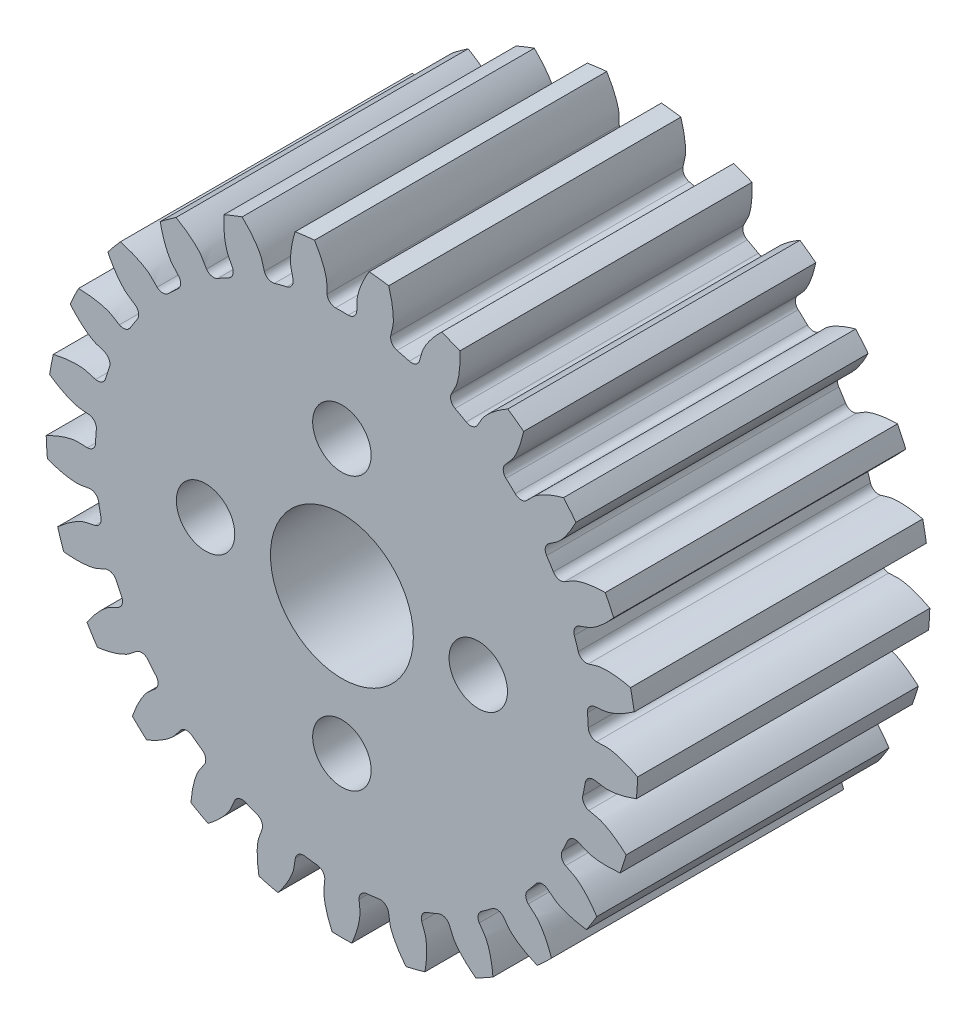
from build123d import *

# Parameters (mm, degrees)
SKETCH_1_R          = 15.1875
LASHENA_DEPTH       = 15
CUT_EXTRUDEA_DEPTH  = 15
WWW_KYTOOL_CN_COUNT = 25
SKETCH_2_R          = 1.5
CUT_EXTRUDE_1_DEPTH = 27.193824405
SKETCH_3_R          = 10.1
CUT_EXTRUDE_2_DEPTH = 5
SKETCH_4_R          = 3.668826936
CUT_EXTRUDE_3_DEPTH = 10


with BuildPart() as part:
    # 草图1 → LaShenA (new body)
    with BuildSketch(Plane.XY):
        Circle(SKETCH_1_R)
    extrude(amount=LASHENA_DEPTH)

    # SketchA → Cut-ExtrudeA (cut)
    with BuildSketch(Plane.XY.offset(15)):
        with BuildLine():
            ThreePointArc((0.324443957, 12.652090743), (0, 12.65625), (-0.324443957, 12.652090743))
            ThreePointArc((-0.324443957, 12.652090743), (-0.622114469, 12.762349707), (-0.76170327, 13.047445726))
            add(Edge.make_bspline(
                [(-0.76170327, 13.047445726), (-0.775328228, 13.228930177), (-0.759394526, 13.44165743), (-0.788755156, 13.664934603), (-0.799675486, 13.722720233), (-0.809304298, 13.768536103), (-0.821659042, 13.821123901), (-0.837010482, 13.880389795), (-0.855686072, 13.946216468), (-0.877989942, 14.018479865), (-0.904228386, 14.097043919), (-0.93470134, 14.181762379), (-0.969704609, 14.272478415), (-1.009528763, 14.369024922), (-1.054459055, 14.471224618), (-1.104775036, 14.578890226), (-1.160750274, 14.691824636), (-1.222652034, 14.809821084), (-1.290740991, 14.932663338), (-1.365270926, 15.060125898), (-1.446488467, 15.191974195), (-1.534632695, 15.327964812), (-1.66440648, 15.518440882), (-1.768856304, 15.660717762), (-1.842005537, 15.755887549)],
                knots=[0.123705737, 0.123705737, 0.123705737, 0.123705737, 0.284026838, 0.310496331, 0.322146932, 0.335915822, 0.351803004, 0.369808477, 0.38993224, 0.412174294, 0.436534639, 0.463013274, 0.491610201, 0.522325418, 0.555158926, 0.590110724, 0.627180814, 0.666369194, 0.707675866, 0.751100828, 0.796644081, 0.844305624, 0.894085459, 1, 1, 1, 1], degree=3))
            ThreePointArc((-1.842005537, 15.755887549), (0, 15.86319567), (1.842005537, 15.755887549))
            add(Edge.make_bspline(
                [(0.76170327, 13.047445726), (0.775328228, 13.228930177), (0.759394526, 13.44165743), (0.788755156, 13.664934603), (0.799675486, 13.722720233), (0.809304298, 13.768536103), (0.821659042, 13.821123901), (0.837010482, 13.880389795), (0.855686072, 13.946216468), (0.877989942, 14.018479865), (0.904228386, 14.097043919), (0.93470134, 14.181762379), (0.969704609, 14.272478415), (1.009528763, 14.369024922), (1.054459055, 14.471224618), (1.104775036, 14.578890226), (1.160750274, 14.691824636), (1.222652034, 14.809821084), (1.290740991, 14.932663338), (1.365270926, 15.060125898), (1.446488467, 15.191974195), (1.534632695, 15.327964812), (1.66440648, 15.518440882), (1.768856304, 15.660717762), (1.842005537, 15.755887549)],
                knots=[0.123705737, 0.123705737, 0.123705737, 0.123705737, 0.284026838, 0.310496331, 0.322146932, 0.335915822, 0.351803004, 0.369808477, 0.38993224, 0.412174294, 0.436534639, 0.463013274, 0.491610201, 0.522325418, 0.555158926, 0.590110724, 0.627180814, 0.666369194, 0.707675866, 0.751100828, 0.796644081, 0.844305624, 0.894085459, 1, 1, 1, 1], degree=3))
            ThreePointArc((0.76170327, 13.047445726), (0.622114469, 12.762349707), (0.324443957, 12.652090743))
        make_face()
    cut_extrudea = extrude(amount=-CUT_EXTRUDEA_DEPTH, mode=Mode.SUBTRACT)

    # www.KYTool.cn: Cut-ExtrudeA ×25 about axis
    www_kytool_cn_axis = Axis((0, 0, -88.99), (0, 0, 1))
    for i in range(1, WWW_KYTOOL_CN_COUNT):
        add(cut_extrudea.rotate(www_kytool_cn_axis, i * 360 / WWW_KYTOOL_CN_COUNT), mode=Mode.SUBTRACT)

    # 草图2 → 切除-拉伸1 (cut, through all)
    with BuildSketch(Plane.XY.offset(15)):
        with Locations((7, 0)):
            Circle(SKETCH_2_R)
        with Locations((0, -7)):
            Circle(SKETCH_2_R)
        with Locations((-7, 0)):
            Circle(SKETCH_2_R)
        with Locations((0, 7)):
            Circle(SKETCH_2_R)
    extrude(amount=-CUT_EXTRUDE_1_DEPTH, mode=Mode.SUBTRACT)

    # 草图3 → 切除-拉伸2 (cut)
    with BuildSketch(Plane(origin=(0, 0, 0), x_dir=(-1, 0, 0), z_dir=(0, 0, -1))):
        Circle(SKETCH_3_R)
    extrude(amount=-CUT_EXTRUDE_2_DEPTH, mode=Mode.SUBTRACT)

    # 草图4 → 切除-拉伸3 (cut)
    with BuildSketch(Plane.XY.offset(15)):
        Circle(SKETCH_4_R)
    extrude(amount=-CUT_EXTRUDE_3_DEPTH, mode=Mode.SUBTRACT)


solid = part.part
